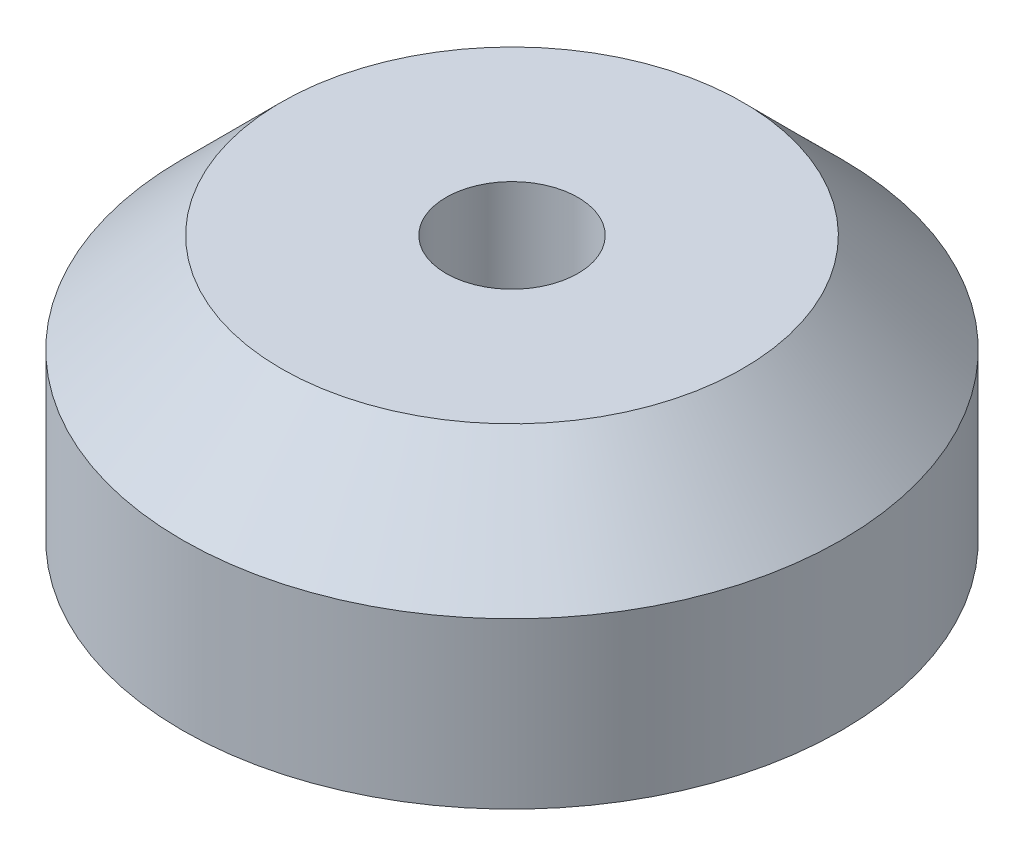
from build123d import *

# Parameters (mm, degrees)
CROQUIS1_R              = 50
CROQUIS1_R_2            = 10
SALIENTE_EXTRUIR1_DEPTH = 40
CHAFL_N1_SIZE           = 15
VACIADO1_T              = -3


with BuildPart() as part:
    # Croquis1 → Saliente-Extruir1 (new body)
    with BuildSketch(Plane(origin=(0, 0, 0), x_dir=(1, 0, 0), z_dir=(0, 1, 0))):
        with Locations(Location((0, 0, 0), (0, 0, 270))):
            Circle(CROQUIS1_R)
        with Locations(Location((0, 0, 0), (0, 0, 270))):
            Circle(CROQUIS1_R_2, mode=Mode.SUBTRACT)
    extrude(amount=SALIENTE_EXTRUIR1_DEPTH)

    # Chaflán1
    chafl_n1_edges = [part.edges().sort_by_distance(p)[0] for p in [
        (0, 40, -50),
    ]]
    chamfer(chafl_n1_edges, length=CHAFL_N1_SIZE)

    # Vaciado1
    vaciado1_openings = [part.faces().sort_by_distance(p)[0] for p in [
        (0, 0, -48.585786438),
    ]]
    offset(amount=VACIADO1_T, openings=vaciado1_openings, kind=Kind.INTERSECTION)


solid = part.part
